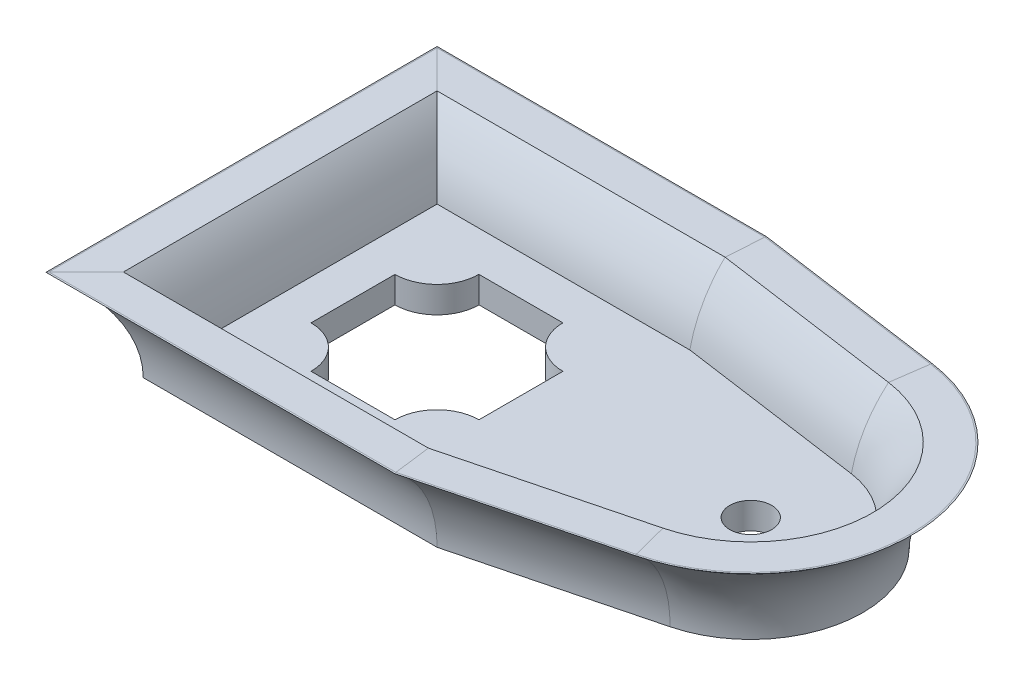
from build123d import *

# Parameters (mm, degrees)
BOSS_EXTRUDE1_REACH     = 19.38
SKETCH3_W               = 4.76
SKETCH3_H               = 0.63
CUT_EXTRUDE1_DEPTH      = 19.196319901
CUT_EXTRUDE1_DEPTH_BACK = 19.196319901
SKETCH4_R               = 0.5


with BuildPart() as part:
    # Sweep1: sweep along a path in Sketch2
    with BuildLine(Plane(origin=(0, 0, 0), x_dir=(1, 0, 0), z_dir=(0, 1, 0))) as sweep1_path:
        Line((0, 2.62), (7, 2.62))
        Line((7, 2.62), (11.415258217, 3.755932179))
        ThreePointArc((11.415258217, 3.755932179), (13.415796262, 6.491493797), (11.121440392, 8.985763424))
        Line((11.121440392, 8.985763424), (6.606732095, 9.62))
        Line((6.606732095, 9.62), (0, 9.62))
        Line((0, 9.62), (0, 2.62))
    # Sketch1 → Sweep1 (sweep)
    with BuildSketch(Plane(origin=(0, 0, 0), x_dir=(0, 0, -1), z_dir=(1, 0, 0))):
        with BuildLine():
            Line((2.62, 0), (3.74, 0))
            Line((3.74, 0), (3.74, 0.63))
            Line((3.74, 0.63), (3.167964646, 0.63))
            ThreePointArc((3.167964646, 0.63), (2.881836518, 1.458738594), (2.383379953, 2.18))
            Line((2.383379953, 2.18), (1.496179773, 2.18))
            ThreePointArc((1.496179773, 2.18), (1.478667505, 2.178597055), (1.46160194, 2.174424008))
            ThreePointArc((1.46160194, 2.174424008), (2.312336165, 1.231869091), (2.62, 0))
        make_face()
    sweep(path=sweep1_path.line, transition=Transition.RIGHT)

    # Sketch3 → Boss-Extrude1 (add, up to next)
    with BuildSketch(Plane(origin=(1.12, 0, 0), x_dir=(0, 0, -1), z_dir=(1, 0, 0)), mode=Mode.PRIVATE) as boss_extrude1_sk1:
        with Locations((6.12, 0.315)):
            Rectangle(SKETCH3_W, SKETCH3_H)
    boss_extrude1_tool1 = extrude(boss_extrude1_sk1.sketch, amount=BOSS_EXTRUDE1_REACH, mode=Mode.PRIVATE) - part.part
    add(boss_extrude1_tool1.solids().sort_by_distance((1.12, 0.315, -6.12))[0])

    # Sketch4 → Cut-Extrude1 (cut, two sides: drawn at the far end of the back side and taken through both)
    with BuildSketch(Plane(origin=(0, 0.63, 0), x_dir=(1, 0, 0), z_dir=(0, 1, 0)).offset(-CUT_EXTRUDE1_DEPTH_BACK)):
        with Locations(Location((10.75, 6.341726352, 0), (0, 0, 270))):
            Circle(SKETCH4_R)
        with BuildLine():
            Line((1.497140147, 7.12), (1.497140147, 5.12))
            ThreePointArc((1.497140147, 5.12), (2.204246928, 4.827106781), (2.497140147, 4.12))
            Line((2.497140147, 4.12), (4.497140147, 4.12))
            ThreePointArc((4.497140147, 4.12), (4.790033365, 4.827106781), (5.497140147, 5.12))
            Line((5.497140147, 5.12), (5.497140147, 7.12))
            ThreePointArc((5.497140147, 7.12), (4.790033365, 7.412893219), (4.497140147, 8.12))
            Line((4.497140147, 8.12), (2.497140147, 8.12))
            ThreePointArc((2.497140147, 8.12), (2.204246928, 7.412893219), (1.497140147, 7.12))
        make_face()
    extrude(amount=CUT_EXTRUDE1_DEPTH + CUT_EXTRUDE1_DEPTH_BACK, mode=Mode.SUBTRACT)


solid = part.part
